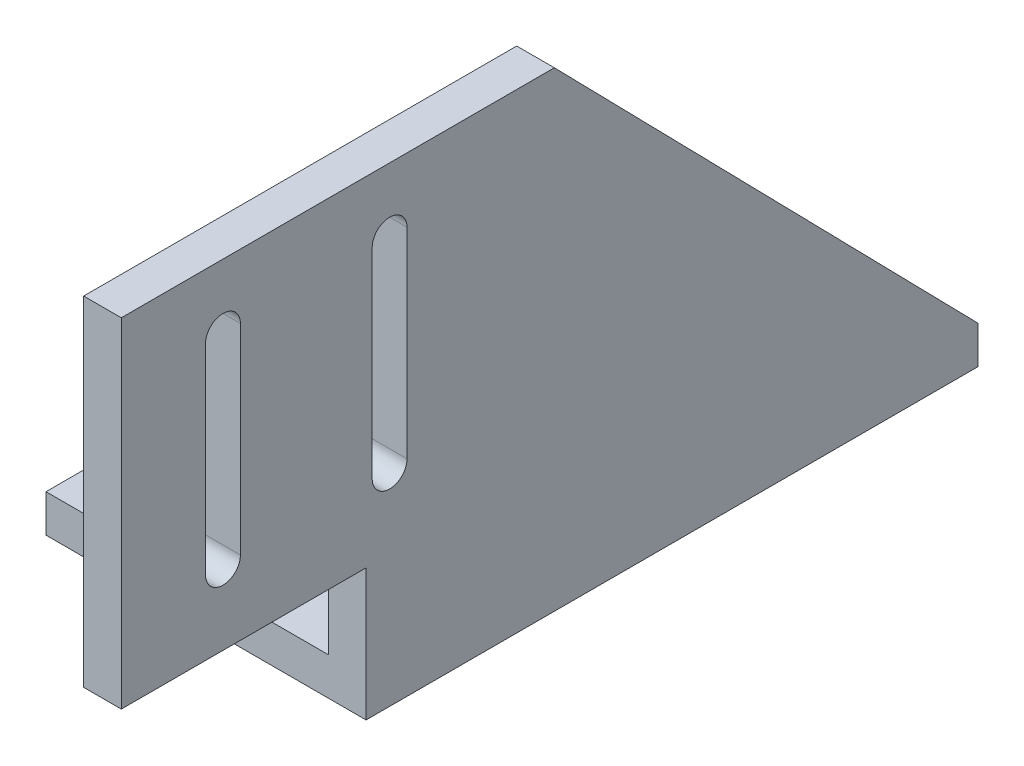
from build123d import *

# Parameters (mm, degrees)
BOSS_EXTRUDE1_DEPTH = 32.5
SKETCH2_R           = 2.75
CUT_EXTRUDE1_DEPTH  = 2
CUT_EXTRUDE2_DEPTH  = 2
SKETCH4_W           = 25
SKETCH4_H           = 13
BOSS_EXTRUDE2_DEPTH = 2
CUT_EXTRUDE3_REACH  = 55.742
CUT_EXTRUDE4_REACH  = 55.742
SKETCH7_W           = 7
SKETCH7_H           = 13


with BuildPart() as part:
    # Sketch1 → Boss-Extrude1 (new body)
    with BuildSketch(Plane(origin=(0, 0, 0), x_dir=(0, 1, 0), z_dir=(0, 0, 1))):
        Polygon((0, 0), (0, -15), (23, -15), (23, -17), (-2, -17), (-2, 0), align=None)
    extrude(amount=BOSS_EXTRUDE1_DEPTH)

    # Sketch2 → Cut-Extrude1 (cut)
    with BuildSketch(Plane.XZ.offset(2)):
        with Locations((8, 25.25)):
            Circle(SKETCH2_R)
        with Locations((8, 7.25)):
            Circle(SKETCH2_R)
    extrude(amount=-CUT_EXTRUDE1_DEPTH, mode=Mode.SUBTRACT)

    # Sketch3 → Cut-Extrude2 (cut)
    with BuildSketch(Plane.YZ.offset(17)):
        Polygon((23, 22.5), (0, 0), (23, 0), align=None)
    extrude(amount=-CUT_EXTRUDE2_DEPTH, mode=Mode.SUBTRACT)

    # Sketch4 → Boss-Extrude2 (add)
    with BuildSketch(Plane.YZ.offset(17)):
        with Locations((10.5, 39)):
            Rectangle(SKETCH4_W, SKETCH4_H)
    extrude(amount=-BOSS_EXTRUDE2_DEPTH)

    # Sketch5 → Cut-Extrude3 (cut, up to next)
    with BuildSketch(Plane.YZ.offset(17), mode=Mode.PRIVATE) as cut_extrude3_sk1:
        with BuildLine():
            Line((8.925, 41.025), (19.575, 41.025))
            ThreePointArc((19.575, 41.025), (20.5, 40.1), (19.575, 39.175))
            Line((19.575, 39.175), (8.925, 39.175))
            ThreePointArc((8.925, 39.175), (8, 40.1), (8.925, 41.025))
        make_face()
    cut_extrude3_tool1 = extrude(cut_extrude3_sk1.sketch, amount=-CUT_EXTRUDE3_REACH, mode=Mode.PRIVATE) & part.part
    # Sketch5 → Cut-Extrude3 (cut, up to next)
    with BuildSketch(Plane.YZ.offset(17), mode=Mode.PRIVATE) as cut_extrude3_sk2:
        with BuildLine():
            Line((8.925, 32.175), (19.575, 32.175))
            ThreePointArc((19.575, 32.175), (20.5, 31.25), (19.575, 30.325))
            Line((19.575, 30.325), (8.925, 30.325))
            ThreePointArc((8.925, 30.325), (8, 31.25), (8.925, 32.175))
        make_face()
    cut_extrude3_tool2 = extrude(cut_extrude3_sk2.sketch, amount=-CUT_EXTRUDE3_REACH, mode=Mode.PRIVATE) & part.part
    add(cut_extrude3_tool1.solids().sort_by_distance((17, 14.25, 40.1))[0], mode=Mode.SUBTRACT)
    add(cut_extrude3_tool2.solids().sort_by_distance((17, 14.25, 31.25))[0], mode=Mode.SUBTRACT)

    # Sketch7 → Cut-Extrude4 (cut, up to next)
    with BuildSketch(Plane.YZ.offset(17), mode=Mode.PRIVATE) as cut_extrude4_sk1:
        with Locations((1.5, 39)):
            Rectangle(SKETCH7_W, SKETCH7_H)
    cut_extrude4_tool1 = extrude(cut_extrude4_sk1.sketch, amount=-CUT_EXTRUDE4_REACH, mode=Mode.PRIVATE) & part.part
    add(cut_extrude4_tool1.solids().sort_by_distance((17, 1.5, 39))[0], mode=Mode.SUBTRACT)


solid = part.part
